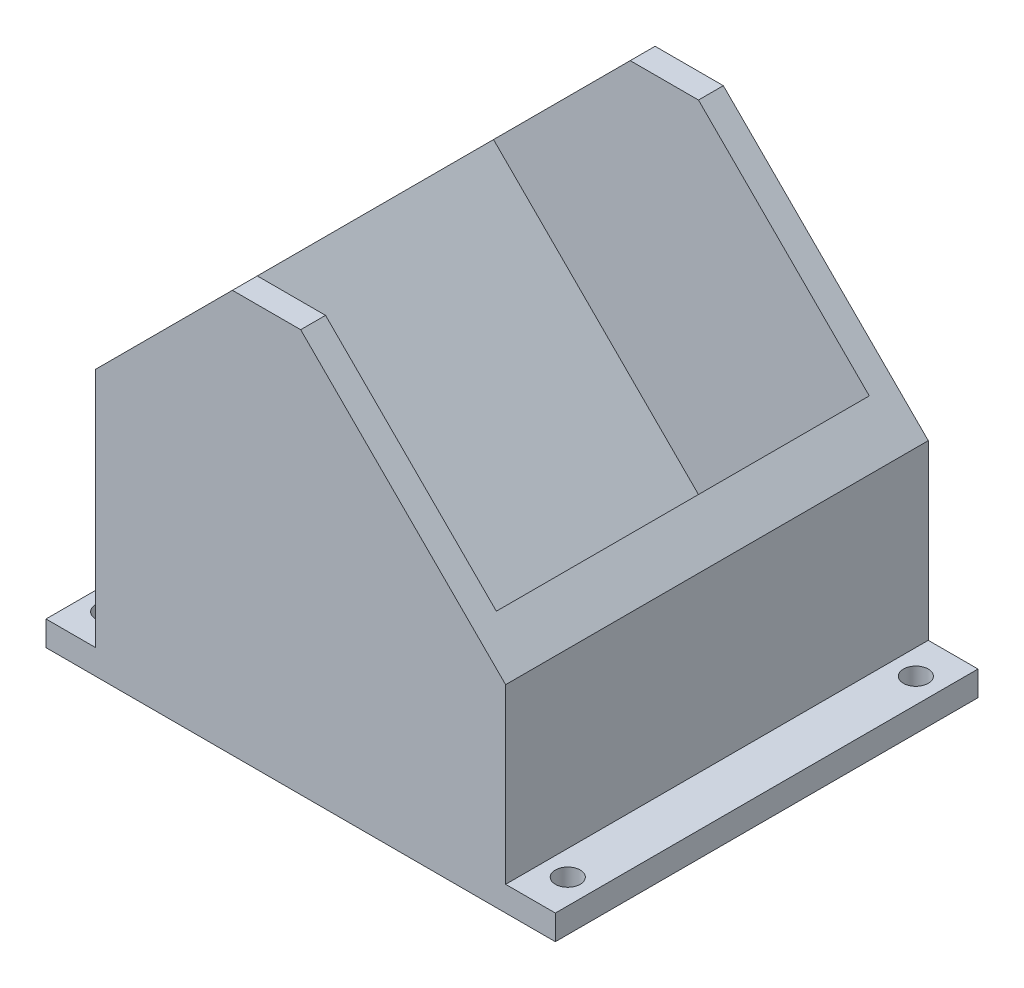
from build123d import *

# Parameters (mm, degrees)
BOSS_EXTRUDE1_DEPTH     = 150
BOSS_EXTRUDE2_DEPTH     = 150
SKETCH6_W               = 164.867200615
SKETCH6_H               = 10
BOSS_EXTRUDE4_DEPTH     = 107
BOSS_EXTRUDE5_DEPTH     = 10
BOSS_EXTRUDE6_DEPTH     = 10
SKETCH9_W               = 20
SKETCH9_H               = 170
SKETCH9_R               = 5
BOSS_EXTRUDE7_DEPTH     = 10
CUT_EXTRUDE2_DEPTH      = 281.132270411
CUT_EXTRUDE2_DEPTH_BACK = 281.132270411
CUT_EXTRUDE3_DEPTH      = 263.34809014
CUT_EXTRUDE3_DEPTH_BACK = 263.34809014


with BuildPart() as part:
    # Sketch2 → Boss-Extrude1 (new body)
    with BuildSketch(Plane.XY):
        Polygon((0, 0), (-97, 0), (-97, 107), (0, 10), align=None)
    extrude(amount=BOSS_EXTRUDE1_DEPTH)

    # Sketch4 → Boss-Extrude2 (add)
    with BuildSketch(Plane.XY.offset(150)):
        Polygon((-14.566399692, 24.566399692), (67.867200615, 107), (67.867200615, 0), (0, 0), (0, 10), align=None)
    extrude(amount=-BOSS_EXTRUDE2_DEPTH)

    # Sketch6 → Boss-Extrude4 (add)
    with BuildSketch(Plane(origin=(0, 0, 0), x_dir=(1, 0, 0), z_dir=(0, 1, 0))):
        with Locations((-14.566399692, -155)):
            Rectangle(SKETCH6_W, SKETCH6_H)
        with Locations((-14.566399692, 5)):
            Rectangle(SKETCH6_W, SKETCH6_H)
    extrude(amount=BOSS_EXTRUDE4_DEPTH)

    # Sketch7 → Boss-Extrude5 (add)
    with BuildSketch(Plane.XY.offset(160)):
        Polygon((-97, 107), (-14.566399692, 189.433600308), (67.867200615, 107), align=None)
    extrude(amount=-BOSS_EXTRUDE5_DEPTH)

    # Sketch8 → Boss-Extrude6 (add)
    with BuildSketch(Plane(origin=(0, 0, -10), x_dir=(-1, 0, 0), z_dir=(0, 0, -1))):
        Polygon((-67.867200615, 107), (97, 107), (14.566399692, 189.433600308), align=None)
    extrude(amount=-BOSS_EXTRUDE6_DEPTH)

    # Sketch9 → Boss-Extrude7 (add)
    # profile 1 of 2: a face of its own
    with BuildSketch(Plane(origin=(0, 0, 0), x_dir=(1, 0, 0), z_dir=(0, 1, 0))):
        with Locations((-107, -75)):
            Rectangle(SKETCH9_W, SKETCH9_H)
        with Locations(Location((-107, -145, 0), (0, 0, 270))):
            Circle(SKETCH9_R, mode=Mode.SUBTRACT)
        with Locations(Location((-107, -5, 0), (0, 0, 270))):
            Circle(SKETCH9_R, mode=Mode.SUBTRACT)
    # profile 2 of 2: a face of its own
    with BuildSketch(Plane(origin=(0, 0, 0), x_dir=(1, 0, 0), z_dir=(0, 1, 0))):
        with Locations((77.867200615, -75)):
            Rectangle(SKETCH9_W, SKETCH9_H)
        with Locations(Location((77.867200615, -145, 0), (0, 0, 90))):
            Circle(SKETCH9_R, mode=Mode.SUBTRACT)
        with Locations(Location((77.867200615, -5, 0), (0, 0, 90))):
            Circle(SKETCH9_R, mode=Mode.SUBTRACT)
    extrude(amount=BOSS_EXTRUDE7_DEPTH)

    # Sketch12 → Cut-Extrude2 (cut, two sides: drawn at the far end of the back side and taken through both)
    with BuildSketch(Plane.XY.offset(160).offset(-CUT_EXTRUDE2_DEPTH_BACK)):
        Polygon((-42.02, 161.98), (12.887200615, 161.98), (-14.566399692, 189.433600308), align=None)
    extrude(amount=CUT_EXTRUDE2_DEPTH + CUT_EXTRUDE2_DEPTH_BACK, mode=Mode.SUBTRACT)

    # Sketch14 → Cut-Extrude3 (cut, two sides: drawn at the far end of the back side and taken through both)
    with BuildSketch(Plane.XY.offset(160).offset(-CUT_EXTRUDE3_DEPTH_BACK)):
        Polygon((-14.566399692, 161.98), (67.867200615, 79.546399692), (67.867200615, 107), (12.887200615, 161.98), align=None)
    extrude(amount=CUT_EXTRUDE3_DEPTH + CUT_EXTRUDE3_DEPTH_BACK, mode=Mode.SUBTRACT)


solid = part.part
